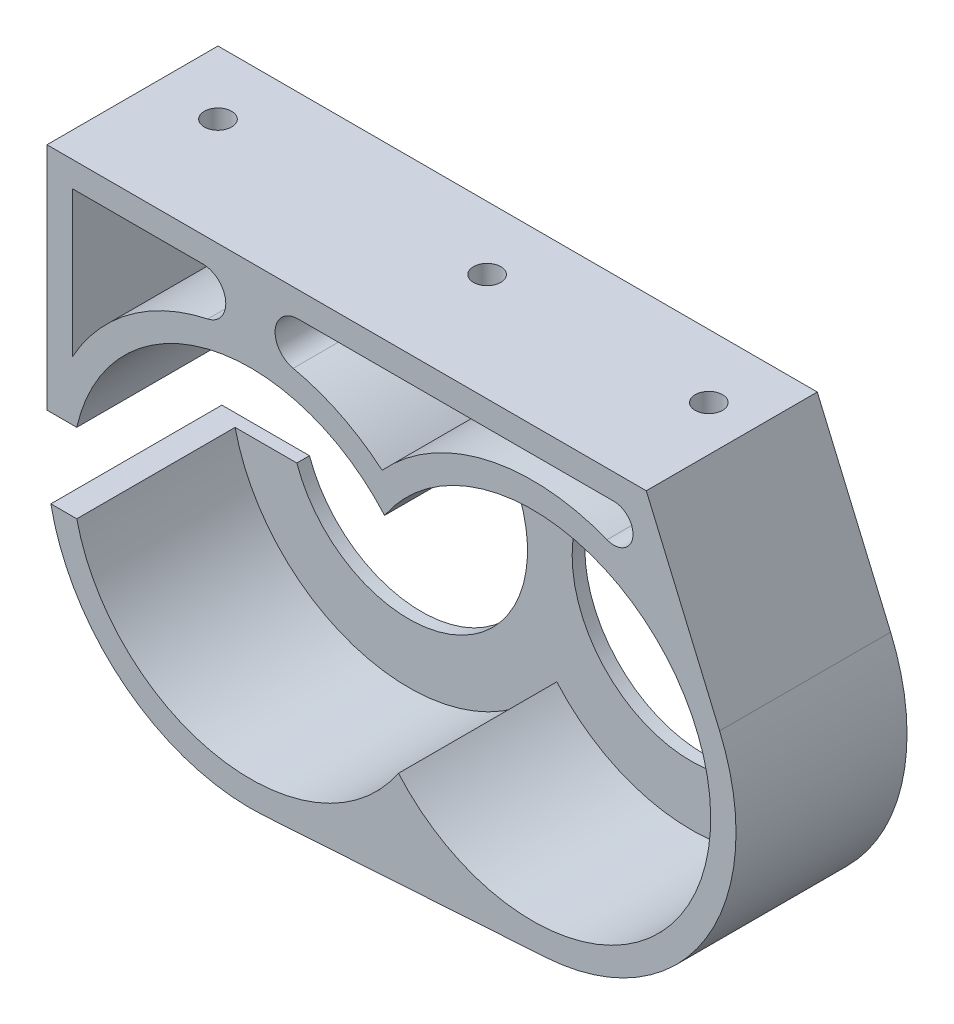
from build123d import *

# Parameters (mm, degrees)
BOSS_EXTRUDE1_DEPTH       = 20
BOSS_EXTRUDE2_START       = 1.6
BOSS_EXTRUDE2_DEPTH       = 1.6
CUT_EXTRUDE1_REACH        = 75.397
CUT_EXTRUDE3_REACH        = 75.397
CUT_EXTRUDE4_REACH        = 75.397
SKETCH6_R                 = 15
F_8_32_TAPPED_HOLE1_D     = 3.4544
F_8_32_TAPPED_HOLE1_DEPTH = 3.2


with BuildPart() as part:
    # Sketch1 → Boss-Extrude1 (new body)
    with BuildSketch(Plane.XY):
        with BuildLine():
            Line((37.281598718, -23.36075752), (1.645598718, -25.647261157))
            ThreePointArc((1.645598718, -25.647261157), (-17.581213168, -18.745424602), (-25.7, 0))
            Line((-25.7, 0), (-25.7, 34.036))
            Line((-25.7, 34.036), (50, 34.036))
            Line((50, 34.036), (59.262043429, 12.400853436))
            ThreePointArc((59.262043429, 12.400853436), (57.530912166, -11.170941189), (37.281598718, -23.36075752))
        make_face()
        with BuildLine():
            ThreePointArc((16.941307547, 14.806826081), (-22.453827861, -1.440699267), (18.694692453, -12.520322444))
            ThreePointArc((18.694692453, -12.520322444), (58.089827861, 3.727202903), (16.941307547, 14.806826081))
        make_face(mode=Mode.SUBTRACT)
    extrude(amount=BOSS_EXTRUDE1_DEPTH)

    # Sketch2 → Boss-Extrude2 (add)
    with BuildSketch(Plane(origin=(0, 0, 0), x_dir=(-1, 0, 0), z_dir=(0, 0, -1)).offset(BOSS_EXTRUDE2_START)):
        with BuildLine():
            Line((25.7, 0), (25.7, 34.036))
            Line((25.7, 34.036), (-50, 34.036))
            Line((-50, 34.036), (-59.262043429, 12.400853436))
            ThreePointArc((-59.262043429, 12.400853436), (-57.530912166, -11.170941189), (-37.281598718, -23.36075752))
            Line((-37.281598718, -23.36075752), (-1.645598718, -25.647261157))
            ThreePointArc((-1.645598718, -25.647261157), (17.581213168, -18.745424602), (25.7, 0))
        make_face()
    extrude(amount=-BOSS_EXTRUDE2_DEPTH)

    # Sketch3 → Cut-Extrude1 (cut, up to next)
    with BuildSketch(Plane.XY.offset(20), mode=Mode.PRIVATE) as cut_extrude1_sk1:
        with BuildLine():
            ThreePointArc((-5.394176999, 25.127531803), (-15.326311164, 20.629934225), (-22.5, 12.419339757))
            Line((-22.5, 12.419339757), (-22.5, 30.836))
            Line((-22.5, 30.836), (-6, 30.836))
            ThreePointArc((-6, 30.836), (-3.129737352, 28.254231355), (-5.394176999, 25.127531803))
        make_face()
    cut_extrude1_tool1 = extrude(cut_extrude1_sk1.sketch, amount=-CUT_EXTRUDE1_REACH, mode=Mode.PRIVATE) & part.part
    # Sketch3 → Cut-Extrude1 (cut, up to next)
    with BuildSketch(Plane.XY.offset(20), mode=Mode.PRIVATE) as cut_extrude1_sk2:
        with BuildLine():
            ThreePointArc((16.634374037, 19.590497707), (11.35689006, 23.054523378), (5.394176999, 25.127531803))
            ThreePointArc((5.394176999, 25.127531803), (3.129737352, 28.254231355), (6, 30.836))
            Line((6, 30.836), (45.922585437, 30.836))
            ThreePointArc((45.922585437, 30.836), (48.2805699, 27.988887856), (45.044015862, 26.202591058))
            ThreePointArc((45.044015862, 26.202591058), (29.810256845, 27.317498757), (16.634374037, 19.590497707))
        make_face()
    cut_extrude1_tool2 = extrude(cut_extrude1_sk2.sketch, amount=-CUT_EXTRUDE1_REACH, mode=Mode.PRIVATE) & part.part
    add(cut_extrude1_tool1.solids().sort_by_distance((-15.04252, 25.299031, 20))[0], mode=Mode.SUBTRACT)
    add(cut_extrude1_tool2.solids().sort_by_distance((22.114051, 27.528579, 20))[0], mode=Mode.SUBTRACT)

    # Sketch5 → Cut-Extrude3 (cut, up to next)
    with BuildSketch(Plane(origin=(0, 0, -1.6), x_dir=(-1, 0, 0), z_dir=(0, 0, -1)), mode=Mode.PRIVATE) as cut_extrude3_sk1:
        with BuildLine():
            Line((25.7, 5), (0, 5))
            ThreePointArc((0, 5), (-5, 0), (0, -5))
            Line((0, -5), (25.20892699, -5))
            ThreePointArc((25.20892699, -5), (25.576937108, -2.512028697), (25.7, 0))
            Line((25.7, 0), (25.7, 5))
        make_face()
    cut_extrude3_tool1 = extrude(cut_extrude3_sk1.sketch, amount=-CUT_EXTRUDE3_REACH, mode=Mode.PRIVATE) & part.part
    add(cut_extrude3_tool1.solids().sort_by_distance((-10.824957, 0.010355, -1.6))[0], mode=Mode.SUBTRACT)

    # Sketch6 → Cut-Extrude4 (cut, up to next)
    with BuildSketch(Plane(origin=(0, 0, -1.6), x_dir=(-1, 0, 0), z_dir=(0, 0, -1)), mode=Mode.PRIVATE) as cut_extrude4_sk1:
        with Locations((-35.636, 2.286503637)):
            Circle(SKETCH6_R)
    cut_extrude4_tool1 = extrude(cut_extrude4_sk1.sketch, amount=-CUT_EXTRUDE4_REACH, mode=Mode.PRIVATE) & part.part
    # Sketch6 → Cut-Extrude4 (cut, up to next)
    with BuildSketch(Plane(origin=(0, 0, -1.6), x_dir=(-1, 0, 0), z_dir=(0, 0, -1)), mode=Mode.PRIVATE) as cut_extrude4_sk2:
        Circle(SKETCH6_R)
    cut_extrude4_tool2 = extrude(cut_extrude4_sk2.sketch, amount=-CUT_EXTRUDE4_REACH, mode=Mode.PRIVATE) & part.part
    add(cut_extrude4_tool1.solids().sort_by_distance((35.636, 2.286504, -1.6))[0], mode=Mode.SUBTRACT)
    add(cut_extrude4_tool2.solids().sort_by_distance((0, 0, -1.6))[0], mode=Mode.SUBTRACT)

    # #8-32 Tapped Hole1
    with Locations(Plane(origin=(0, 34.036, 0), x_dir=(1, 0, 0), z_dir=(0, 1, 0))):
        with Locations((16.3, -6.4), (-17.7, -6.4), (44.3, -6.4)):
            Hole(F_8_32_TAPPED_HOLE1_D / 2, depth=F_8_32_TAPPED_HOLE1_DEPTH)


solid = part.part
